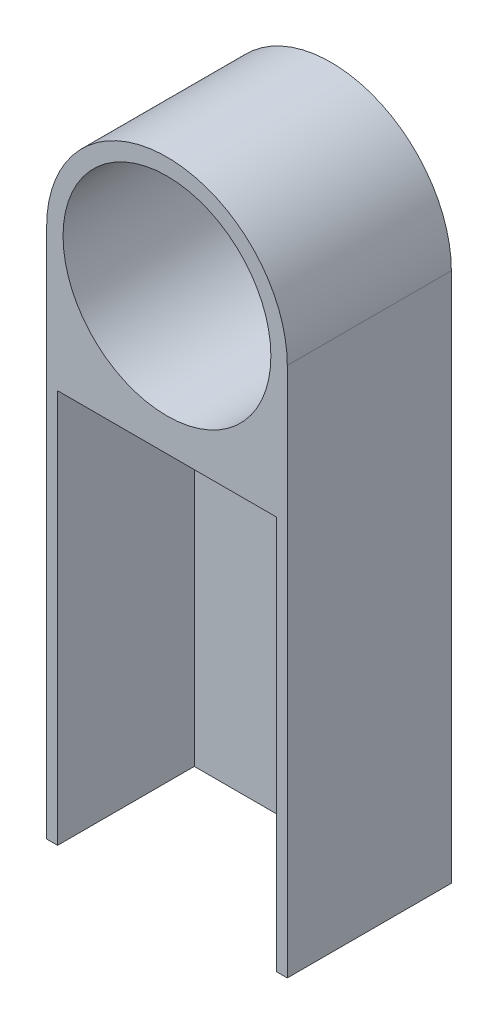
from build123d import *

# Parameters (mm, degrees)
SKETCH1_R           = 22
SKETCH1_R_2         = 19
BOSS_EXTRUDE1_DEPTH = 30
SKETCH2_W           = 40
SKETCH2_H           = 70
CUT_EXTRUDE1_DEPTH  = 25
SKETCH3_W           = 44
SKETCH3_H           = 13
CUT_EXTRUDE2_DEPTH  = 117.120626936
SKETCH4_W           = 40
SKETCH4_H           = 25
CUT_EXTRUDE3_DEPTH  = 25


with BuildPart() as part:
    # Sketch1 → Boss-Extrude1 (new body)
    # profile 1 of 2: a face of its own
    with BuildSketch(Plane.XY):
        Circle(SKETCH1_R)
        Circle(SKETCH1_R_2, mode=Mode.SUBTRACT)
    # profile 2 of 2: a face of its own
    with BuildSketch(Plane.XY):
        with BuildLine():
            Line((22, -110), (22, 0))
            ThreePointArc((22, 0), (0, -22), (-22, 0))
            Line((-22, 0), (-22, -110))
            Line((-22, -110), (22, -110))
        make_face()
    extrude(amount=BOSS_EXTRUDE1_DEPTH)

    # Sketch2 → Cut-Extrude1 (cut)
    with BuildSketch(Plane.XY.offset(30)):
        with Locations((0, -60)):
            Rectangle(SKETCH2_W, SKETCH2_H)
    extrude(amount=-CUT_EXTRUDE1_DEPTH, mode=Mode.SUBTRACT)

    # Sketch3 → Cut-Extrude2 (cut, through all)
    with BuildSketch(Plane.XY.offset(30)):
        with Locations((0, -103.5)):
            Rectangle(SKETCH3_W, SKETCH3_H)
    extrude(amount=-CUT_EXTRUDE2_DEPTH, mode=Mode.SUBTRACT)

    # Sketch4 → Cut-Extrude3 (cut)
    with BuildSketch(Plane(origin=(0, -95, 0), x_dir=(1, 0, 0), z_dir=(0, 1, 0))):
        with Locations((0, -17.5)):
            Rectangle(SKETCH4_W, SKETCH4_H)
    extrude(amount=-CUT_EXTRUDE3_DEPTH, mode=Mode.SUBTRACT)


solid = part.part
